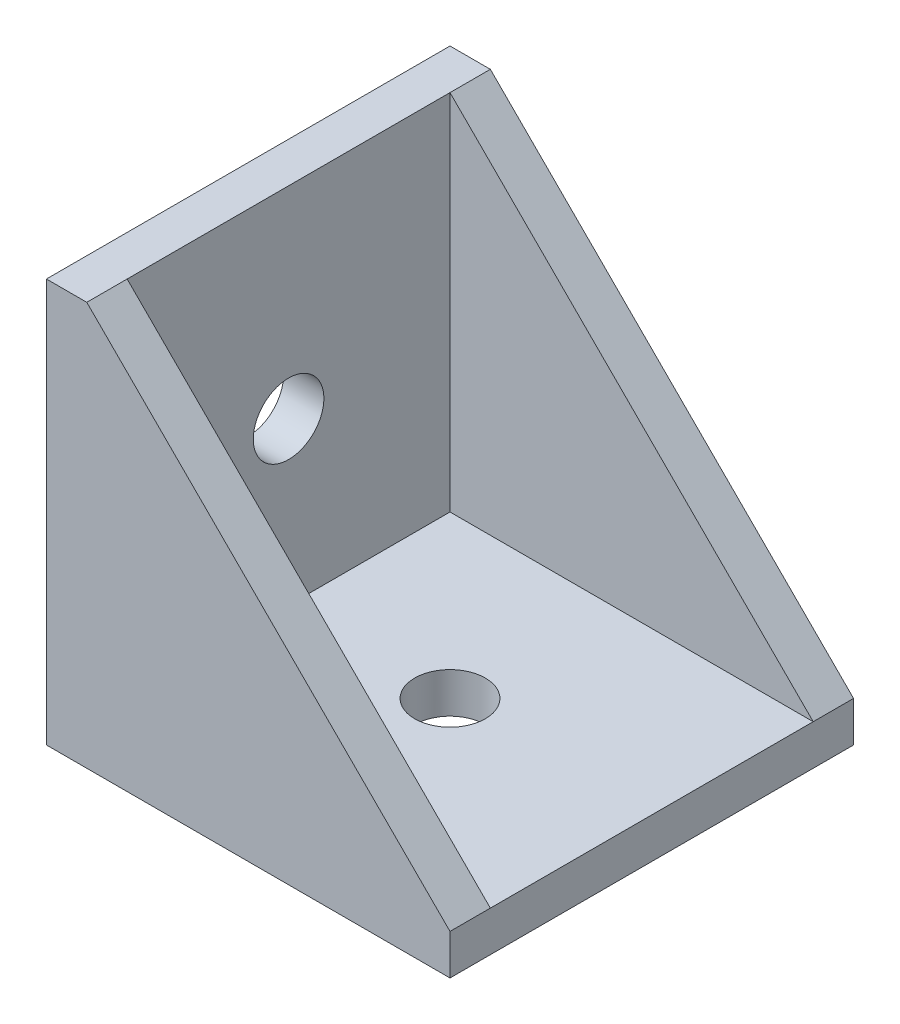
from build123d import *

# Parameters (mm, degrees)
EXTRUDE_1_DEPTH     = 20
SKETCH_2_W          = 18
SKETCH_2_H          = 16
CUT_EXTRUDE_1_DEPTH = 18
SKETCH_3_R          = 1.75
CUT_EXTRUDE_2_DEPTH = 18
SKETCH_4_R          = 1.75
CUT_EXTRUDE_3_DEPTH = 18


with BuildPart() as part:
    # 草图1 → 凸台-拉伸1 (new body)
    with BuildSketch(Plane.XY):
        Polygon((2, 20), (20, 2), (20, 0), (0, 0), (0, 20), align=None)
    extrude(amount=EXTRUDE_1_DEPTH)

    # 草图2 → 切除-拉伸1 (cut)
    with BuildSketch(Plane(origin=(0, 20, 0), x_dir=(1, 0, 0), z_dir=(0, 1, 0))):
        with Locations((11, -10)):
            Rectangle(SKETCH_2_W, SKETCH_2_H)
    extrude(amount=-CUT_EXTRUDE_1_DEPTH, mode=Mode.SUBTRACT)

    # 草图3 → 切除-拉伸2 (cut)
    with BuildSketch(Plane.XZ):
        with Locations(Location((10, 10, 0), (0, 0, 270))):
            Circle(SKETCH_3_R)
    extrude(amount=-CUT_EXTRUDE_2_DEPTH, mode=Mode.SUBTRACT)

    # 草图4 → 切除-拉伸3 (cut)
    with BuildSketch(Plane.ZY):
        with Locations((10, 10)):
            Circle(SKETCH_4_R)
    extrude(amount=-CUT_EXTRUDE_3_DEPTH, mode=Mode.SUBTRACT)


solid = part.part
